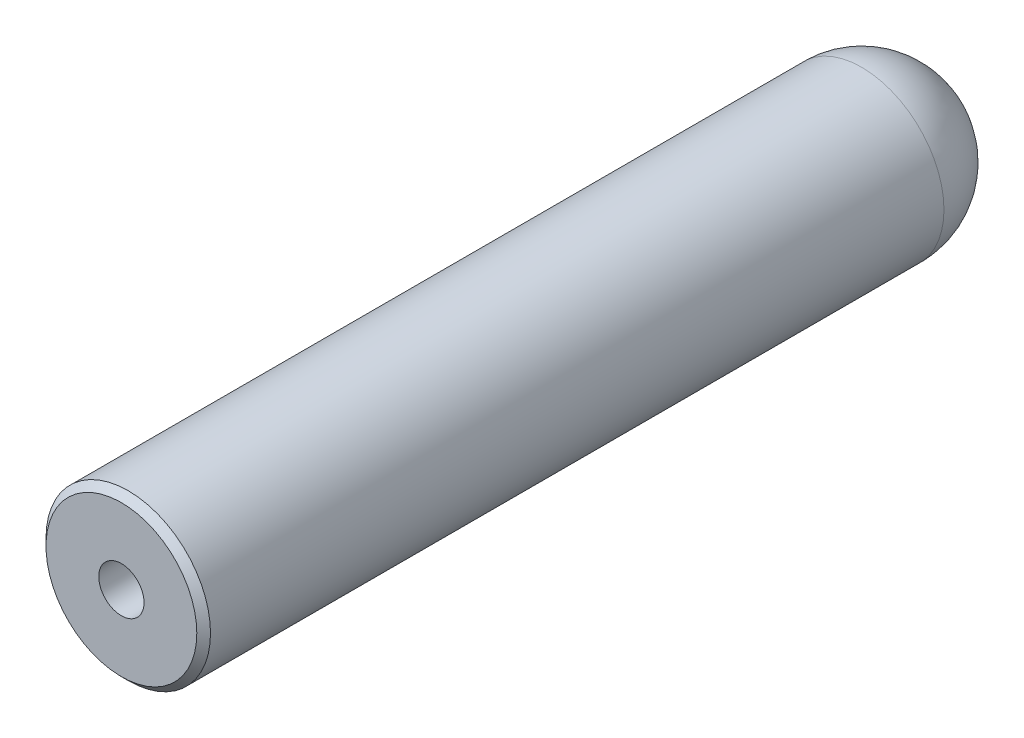
from build123d import *

# Parameters (mm, degrees)
SKETCH_1_R             = 6
EXTRUDE_1_DEPTH        = 60
FILLET_1_R             = 6
CHAMFER_1_SIZE         = 0.5
HOLE_WIZARD_M4_1_D     = 3.3
HOLE_WIZARD_M4_1_DEPTH = 11.5
HOLE_WIZARD_M4_1_TIP   = 0.991420021


with BuildPart() as part:
    # 草圖1 → 伸長1 (new body)
    with BuildSketch(Plane.XY):
        Circle(SKETCH_1_R)
    extrude(amount=EXTRUDE_1_DEPTH)

    # 圓角1
    fillet_1_edges = [part.edges().sort_by_distance(p)[0] for p in [
        (-6, 0, 0),
    ]]
    fillet(fillet_1_edges, radius=FILLET_1_R)

    # 導角1
    chamfer_1_edges = [part.edges().sort_by_distance(p)[0] for p in [
        (-6, 0, 60),
    ]]
    chamfer(chamfer_1_edges, length=CHAMFER_1_SIZE)

    # M4 螺紋孔1
    with Locations(Plane.XY.offset(60)):
        with Locations((0, 0)):
            Hole(HOLE_WIZARD_M4_1_D / 2, depth=HOLE_WIZARD_M4_1_DEPTH)
            with Locations((0, 0, -(HOLE_WIZARD_M4_1_DEPTH + HOLE_WIZARD_M4_1_TIP / 2))):  # 118° drill point
                Cone(0, HOLE_WIZARD_M4_1_D / 2, HOLE_WIZARD_M4_1_TIP, mode=Mode.SUBTRACT)


solid = part.part
